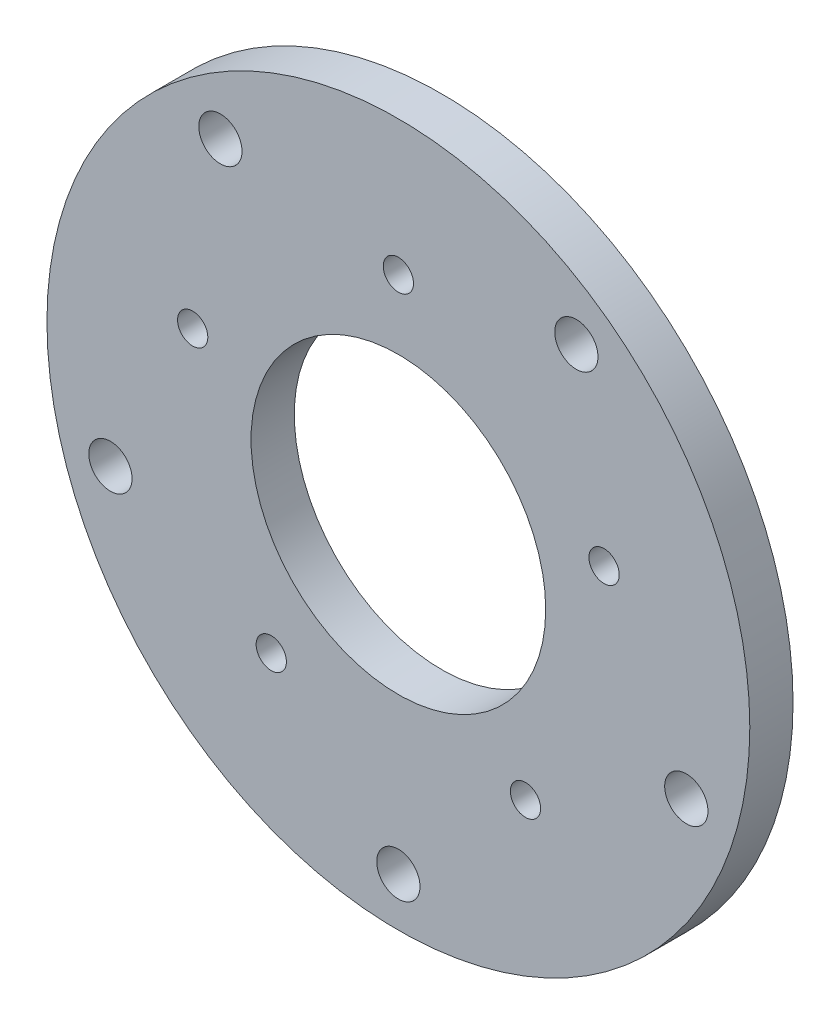
from build123d import *

# Parameters (mm, degrees)
SKETCH_1_R      = 32.5
SKETCH_1_R_2    = 13.625
SKETCH_1_R_3    = 2
SKETCH_1_R_4    = 1.4
EXTRUDE_1_DEPTH = 4


with BuildPart() as part:
    # 草图1 → 凸台-拉伸1 (new body)
    with BuildSketch(Plane.XY):
        with Locations((-0.261189045, 0.652972612)):
            Circle(SKETCH_1_R)
        with Locations((-0.261189045, 0.652972612)):
            Circle(SKETCH_1_R_2, mode=Mode.SUBTRACT)
        with Locations((-0.261189045, -27.347027388)):
            Circle(SKETCH_1_R_3, mode=Mode.SUBTRACT)
        with Locations((-26.890771501, -7.999503231)):
            Circle(SKETCH_1_R_3, mode=Mode.SUBTRACT)
        with Locations((-16.719176109, 23.305448454)):
            Circle(SKETCH_1_R_3, mode=Mode.SUBTRACT)
        with Locations((16.196798019, 23.305448454)):
            Circle(SKETCH_1_R_3, mode=Mode.SUBTRACT)
        with Locations((26.368393412, -7.999503231)):
            Circle(SKETCH_1_R_3, mode=Mode.SUBTRACT)
        with Locations((-12.016894091, -15.527367276)):
            Circle(SKETCH_1_R_4, mode=Mode.SUBTRACT)
        with Locations((-19.282319371, 6.833312499)):
            Circle(SKETCH_1_R_4, mode=Mode.SUBTRACT)
        with Locations((-0.261189045, 20.652972612)):
            Circle(SKETCH_1_R_4, mode=Mode.SUBTRACT)
        with Locations((18.759941281, 6.833312499)):
            Circle(SKETCH_1_R_4, mode=Mode.SUBTRACT)
        with Locations((11.494516001, -15.527367276)):
            Circle(SKETCH_1_R_4, mode=Mode.SUBTRACT)
    extrude(amount=EXTRUDE_1_DEPTH)


solid = part.part
